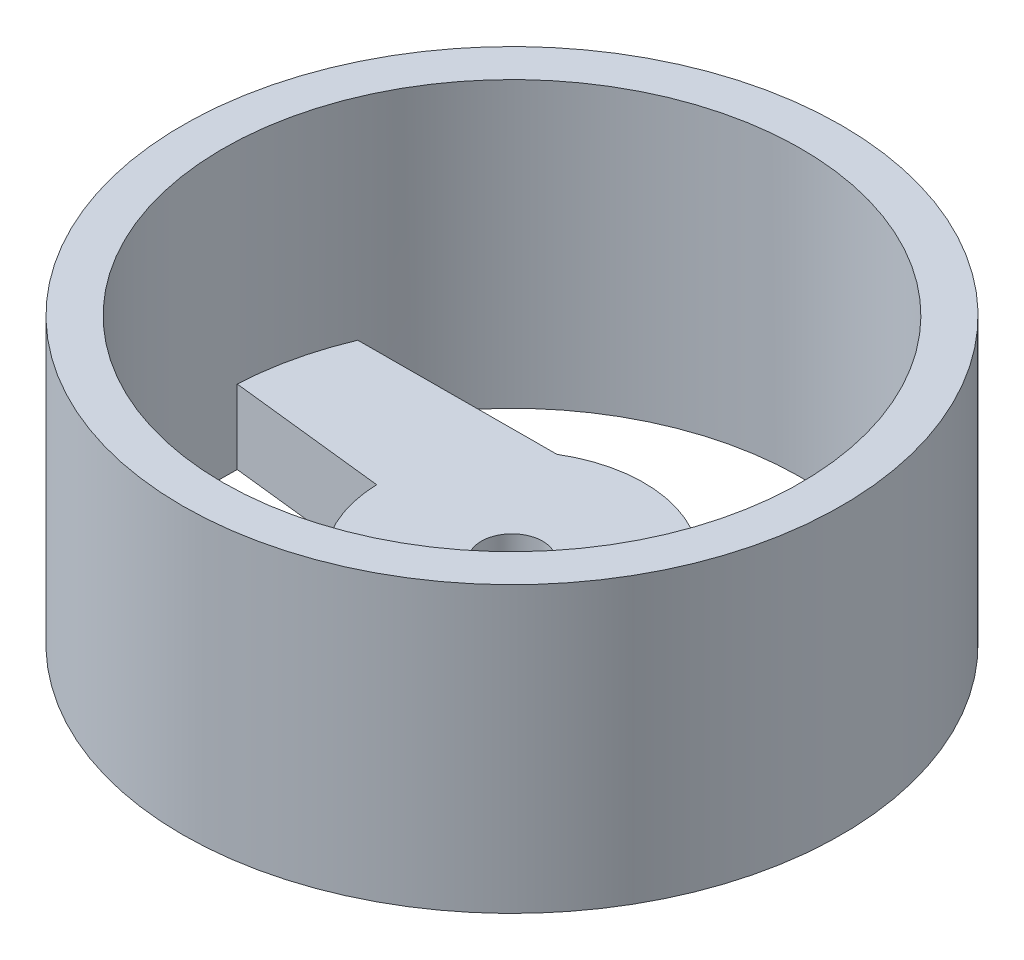
from build123d import *

# Parameters (mm, degrees)
CROQUIS1_W              = 10.950949918
CROQUIS1_H              = 9.461001059
CROQUIS2_R              = 4
SALIENTE_EXTRUIR1_DEPTH = 4
CORTAR_EXTRUIR1_DEPTH   = 10
MATRIZC1_COUNT          = 3
CORTAR_EXTRUIR2_START   = -7
CROQUIS8_R              = 9.607815028
CORTAR_EXTRUIR2_DEPTH   = 7
CROQUIS9_R              = 1.019703071
CORTAR_EXTRUIR3_DEPTH   = 21.519384926
ESCALA1_SCALE           = 0.565


with BuildPart() as part:
    # Croquis1 → Revolución1 (revolve)
    with BuildSketch(Plane(origin=(0, 0, 0), x_dir=(-1, 0, 0), z_dir=(0, 0, -1)), mode=Mode.PRIVATE) as revoluci_n1_sk:
        with Locations((-5.475474959, 8.73050053)):
            Rectangle(CROQUIS1_W, CROQUIS1_H)
    revolve(revoluci_n1_sk.sketch.rotate(Axis((0, 4, 0), (0, 1, 0)), 270), axis=Axis((0, 4, 0), (0, 1, 0)))

    # Croquis2 → Saliente-Extruir1 (add)
    with BuildSketch(Plane.XZ.offset(-4)):
        with Locations(Location((0, 0, 0), (0, 0, 270))):
            Circle(CROQUIS2_R)
    extrude(amount=SALIENTE_EXTRUIR1_DEPTH)

    # Croquis7 → Cortar-Extruir1 (cut)
    with BuildSketch(Plane.XZ.offset(-4)):
        with BuildLine():
            Line((2.290412928, 3.737743004), (4.394709568, 8.543806963))
            ThreePointArc((4.394709568, 8.543806963), (9.368666462, 2.13030475), (7.657065469, -5.803400555))
            Line((7.657065469, -5.803400555), (4.382944907, -0.080672706))
            ThreePointArc((4.382944907, -0.080672706), (3.844281576, 2.106706746), (2.290412928, 3.737743004))
        make_face()
    cortar_extruir1 = extrude(amount=-CORTAR_EXTRUIR1_DEPTH, mode=Mode.SUBTRACT)

    # MatrizC1: Cortar-Extruir1 ×3 about axis
    matrizc1_axis = Axis((0, 0, 0), (0, 1, 0))
    for i in range(1, MATRIZC1_COUNT):
        add(cortar_extruir1.rotate(matrizc1_axis, i * 360 / MATRIZC1_COUNT), mode=Mode.SUBTRACT)

    # Croquis8 → Cortar-Extruir2 (cut)
    with BuildSketch(Plane(origin=(0, 13.461001059, 0), x_dir=(1, 0, 0), z_dir=(0, 1, 0)).offset(CORTAR_EXTRUIR2_START)):
        with Locations(Location((0, 0, 0), (0, 0, 57.220098004))):
            Circle(CROQUIS8_R)
    extrude(amount=CORTAR_EXTRUIR2_DEPTH, mode=Mode.SUBTRACT)

    # Croquis9 → Cortar-Extruir3 (cut, through all)
    with BuildSketch(Plane.XZ):
        with Locations(Location((0, 0, 0), (0, 0, 270))):
            Circle(CROQUIS9_R)
    extrude(amount=-CORTAR_EXTRUIR3_DEPTH, mode=Mode.SUBTRACT)


with BuildPart() as part_1:
    # Escala1: scaled about (0, 6.977093027, 0)
    add(part.part.scale(ESCALA1_SCALE).moved(Location((0, 3.035035467, 0))))


solid = part_1.part
